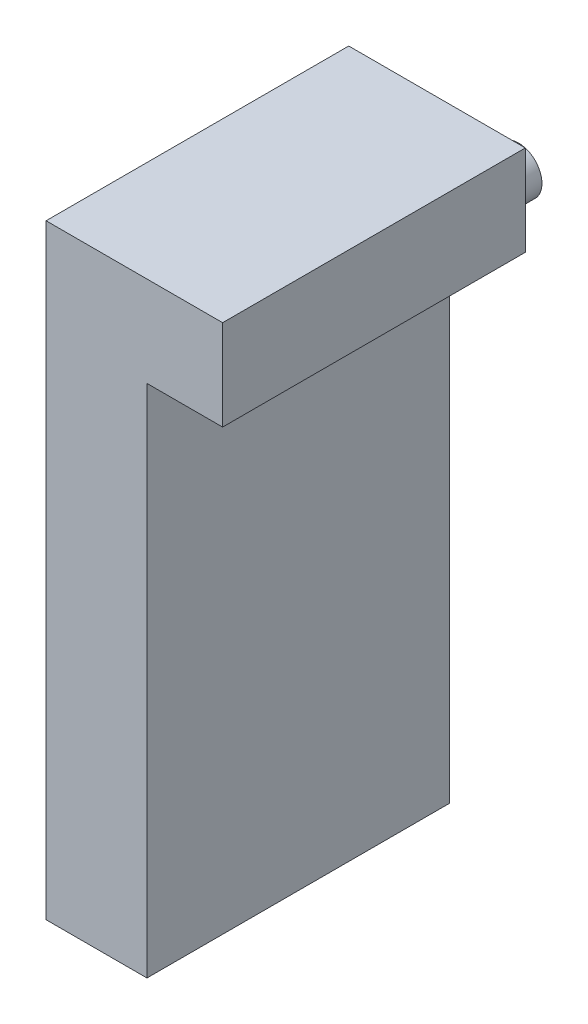
from build123d import *

# Parameters (mm, degrees)
SKETCH1_W           = 20
SKETCH1_H           = 60
BOSS_EXTRUDE1_DEPTH = 120
SKETCH2_W           = 60
SKETCH2_H           = 17.921787448
BOSS_EXTRUDE2_DEPTH = 15
SKETCH3_R           = 4.625
BOSS_EXTRUDE3_DEPTH = 5


with BuildPart() as part:
    # Sketch1 → Boss-Extrude1 (new body)
    with BuildSketch(Plane(origin=(0, 0, 0), x_dir=(1, 0, 0), z_dir=(0, 1, 0))):
        with Locations((-10, 30)):
            Rectangle(SKETCH1_W, SKETCH1_H)
    extrude(amount=BOSS_EXTRUDE1_DEPTH)

    # Sketch2 → Boss-Extrude2 (add)
    with BuildSketch(Plane(origin=(0, 0, 0), x_dir=(0, 0, -1), z_dir=(1, 0, 0))):
        with Locations((30, 111.039106276)):
            Rectangle(SKETCH2_W, SKETCH2_H)
    extrude(amount=BOSS_EXTRUDE2_DEPTH)

    # Sketch3 → Boss-Extrude3 (add)
    with BuildSketch(Plane(origin=(0, 0, -60), x_dir=(-1, 0, 0), z_dir=(0, 0, -1))):
        with Locations(Location((-8.672680841, 110.56115287, 0), (0, 0, 180))):
            Circle(SKETCH3_R)
    extrude(amount=BOSS_EXTRUDE3_DEPTH)


solid = part.part
